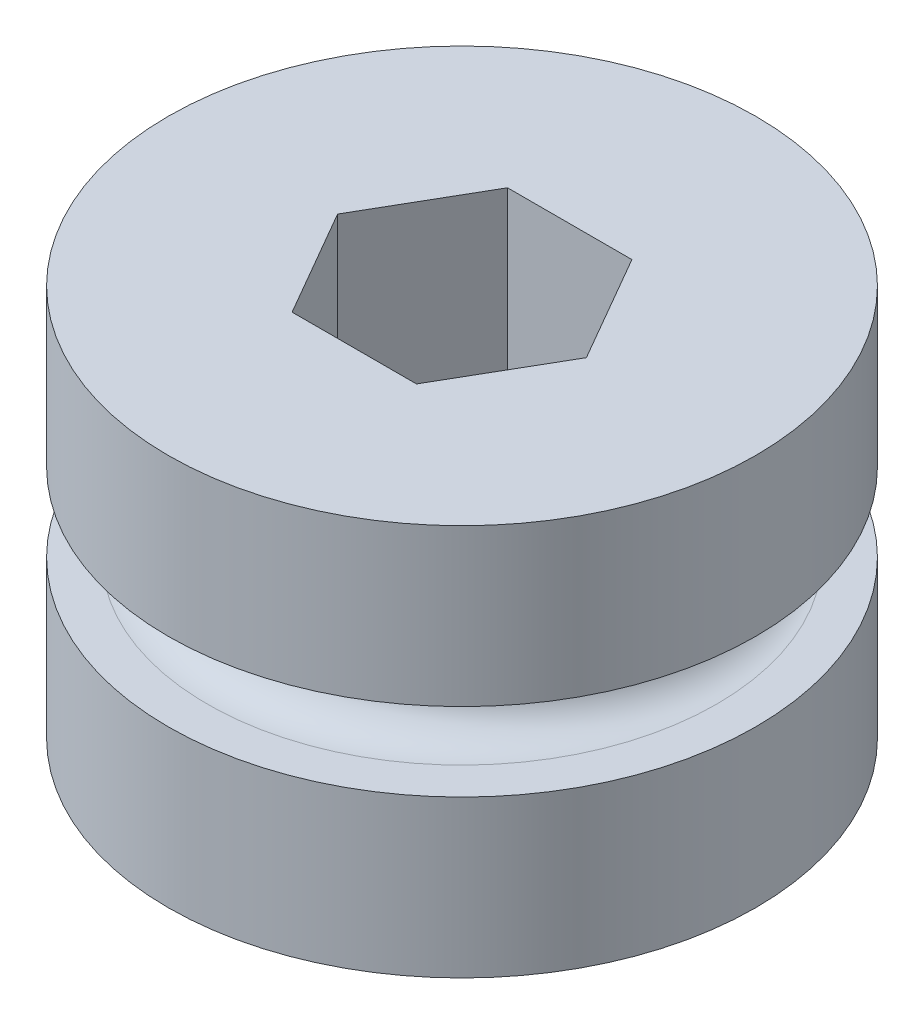
from build123d import *

# Parameters (mm, degrees)
SKETCH2_R           = 19.05
BOSS_EXTRUDE1_DEPTH = 25.4
CUT_EXTRUDE1_DEPTH  = 38.026544532


with BuildPart() as part:
    # Sketch2 → Boss-Extrude1 (new body)
    with BuildSketch(Plane(origin=(0, 0, 0), x_dir=(1, 0, 0), z_dir=(0, 1, 0))):
        with Locations(Location((0, 0, 0), (0, 0, 270))):
            Circle(SKETCH2_R)
    extrude(amount=BOSS_EXTRUDE1_DEPTH)

    # Sketch4 → Cut-Revolve2 (revolve, cut)
    with BuildSketch(Plane.XY, mode=Mode.PRIVATE) as cut_revolve2_sk:
        with BuildLine():
            Line((-16.51, 15.24), (-19.05, 15.24))
            Line((-19.05, 15.24), (-19.05, 10.16))
            Line((-19.05, 10.16), (-16.51, 10.16))
            ThreePointArc((-16.51, 10.16), (-13.97, 12.7), (-16.51, 15.24))
        make_face()
    revolve(cut_revolve2_sk.sketch.rotate(Axis((0, 0, 0), (0, 1, 0)), 180), axis=Axis((0, 0, 0), (0, 1, 0)), mode=Mode.SUBTRACT)

    # Sketch7 → Cut-Extrude1 (cut, through all)
    with BuildSketch(Plane(origin=(0, 25.4, 0), x_dir=(1, 0, 0), z_dir=(0, 1, 0))):
        Polygon((8.065583261, 0), (4.03279163, 6.985), (-4.03279163, 6.985), (-8.065583261, 0), (-4.03279163, -6.985), (4.03279163, -6.985), align=None)
    extrude(amount=-CUT_EXTRUDE1_DEPTH, mode=Mode.SUBTRACT)


solid = part.part
